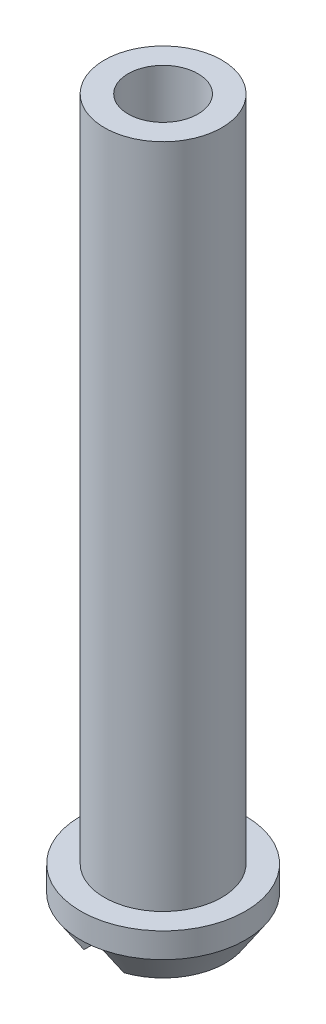
from build123d import *

# Parameters (mm, degrees)
CHAMFER2_SIZE           = 1.778
CHAMFER2_SIZE2          = 2.54
CUT_EXTRUDE1_DEPTH      = 75.35695451
CUT_EXTRUDE1_DEPTH_BACK = 75.35695451
SKETCH2_W               = 4.064
SKETCH2_H               = 3.048
CUT_EXTRUDE2_DEPTH      = 75.35695451
CUT_EXTRUDE2_DEPTH_BACK = 75.35695451


with BuildPart() as part:
    # Sketch1 → Base-Revolve (revolve)
    with BuildSketch(Plane.XY, mode=Mode.PRIVATE) as base_revolve_sk:
        Polygon((3.556, 73.406), (3.556, 0), (6.35, 0), (8.382, 3.048), (8.382, 5.588), (5.969, 5.588), (5.969, 73.406), align=None)
    revolve(base_revolve_sk.sketch.rotate(Axis((0, 0, 0), (0, 1, 0)), 90), axis=Axis((0, 0, 0), (0, 1, 0)))

    # Chamfer2
    chamfer2_edges = [part.edges().sort_by_distance(p)[0] for p in [
        (0, 0, 3.556),
    ]]
    chamfer2_side = [part.faces().sort_by_distance(p)[0] for p in [
        (0, 0, 3.735605122),
    ]]
    chamfer(chamfer2_edges, length=CHAMFER2_SIZE, length2=CHAMFER2_SIZE2, reference=chamfer2_side[0])

    # Sketch2 → Cut-Extrude1 (cut, two sides: drawn at the far end of the back side and taken through both)
    with BuildSketch(Plane.XY.offset(-CUT_EXTRUDE1_DEPTH_BACK)):
        with Locations((0, 1.524)):
            Rectangle(SKETCH2_W, SKETCH2_H)
    extrude(amount=CUT_EXTRUDE1_DEPTH + CUT_EXTRUDE1_DEPTH_BACK, mode=Mode.SUBTRACT)

    # Sketch3 → Cut-Extrude2 (cut, two sides: drawn at the far end of the back side and taken through both)
    with BuildSketch(Plane.XY.offset(-CUT_EXTRUDE2_DEPTH_BACK)):
        Polygon((-7.874, 5.08), (-7.874, 2.286), (-8.382, 3.048), (-8.382, 5.08), align=None)
    extrude(amount=CUT_EXTRUDE2_DEPTH + CUT_EXTRUDE2_DEPTH_BACK, mode=Mode.SUBTRACT)


solid = part.part
